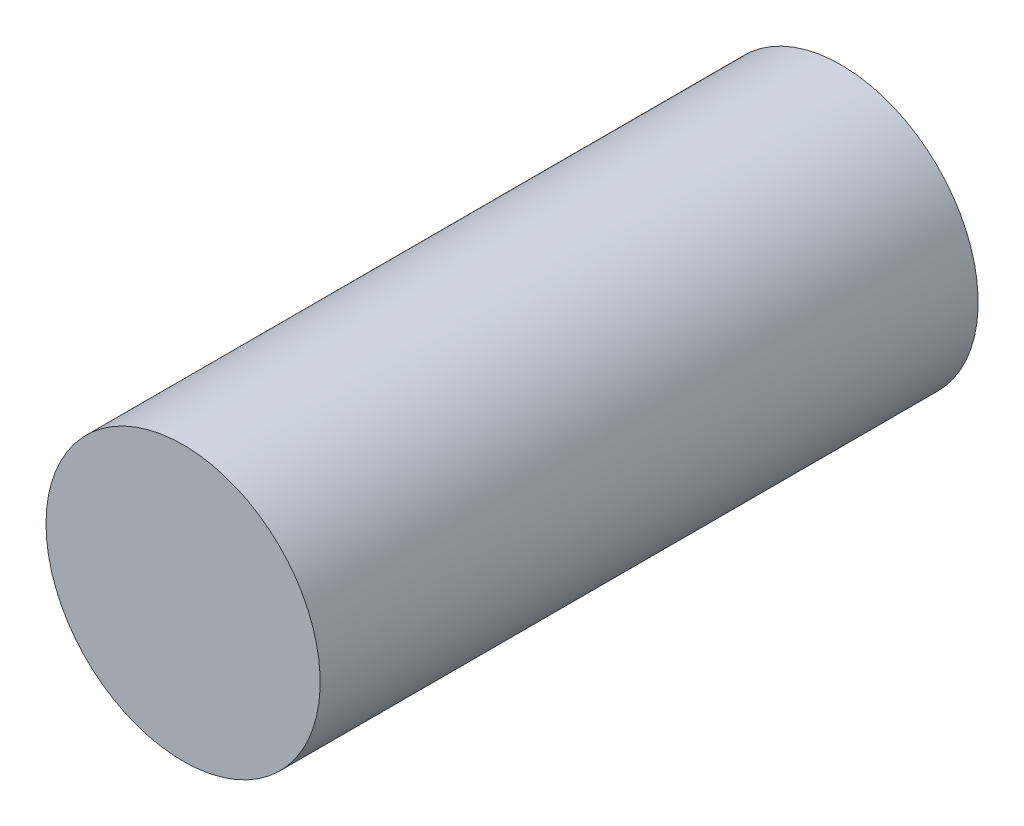
from build123d import *

# Parameters (mm, degrees)
SKETCH1_R           = 63.5
BOSS_EXTRUDE1_DEPTH = 304.8


with BuildPart() as part:
    # Sketch1 → Boss-Extrude1 (new body)
    with BuildSketch(Plane.XY):
        with Locations(Location((0, 0, 0), (0, 0, 180))):
            Circle(SKETCH1_R)
    extrude(amount=BOSS_EXTRUDE1_DEPTH)


solid = part.part
